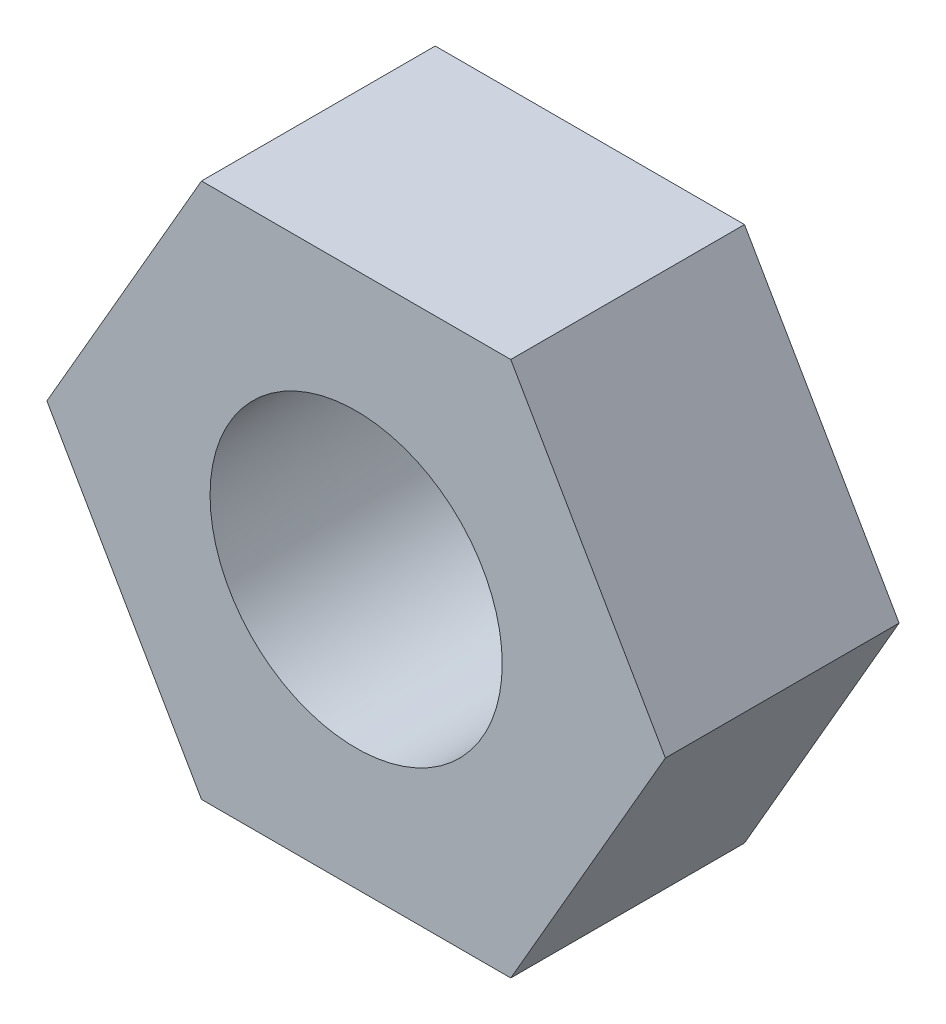
from build123d import *

# Parameters (mm, degrees)
BOSS_EXTRUDE1_DEPTH = 2.4
SKETCH3_R           = 1.5
CUT_EXTRUDE1_DEPTH  = 2.4


with BuildPart() as part:
    # Sketch2 → Boss-Extrude1 (new body)
    with BuildSketch(Plane.XY):
        Polygon((3.175426481, 0), (1.58771324, 2.75), (-1.58771324, 2.75), (-3.175426481, 0), (-1.58771324, -2.75), (1.58771324, -2.75), align=None)
    extrude(amount=BOSS_EXTRUDE1_DEPTH)

    # Sketch3 → Cut-Extrude1 (cut)
    with BuildSketch(Plane(origin=(0, 0, 0), x_dir=(-1, 0, 0), z_dir=(0, 0, -1))):
        Circle(SKETCH3_R)
    extrude(amount=-CUT_EXTRUDE1_DEPTH, mode=Mode.SUBTRACT)


solid = part.part
